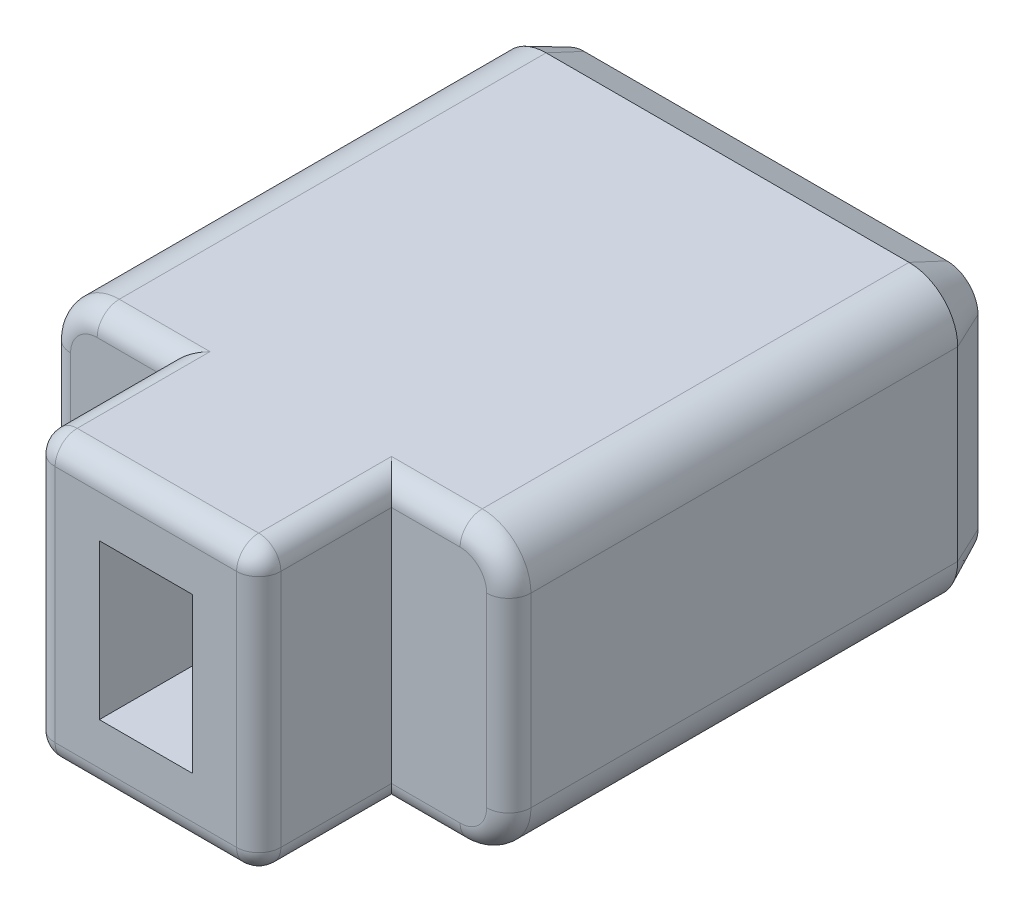
from build123d import *

# Parameters (mm, degrees)
BOSS_EXTRU_1_DEPTH      = 14
ESQUISSE3_W             = 2.1
ESQUISSE3_H             = 3.5
ENL_V_MAT_EXTRU_1_DEPTH = 3
ESQUISSE4_OUTSIDE_W     = 16.116
ESQUISSE4_OUTSIDE_H     = 12.116
ESQUISSE4_OUTSIDE_W_2   = 5.1
ESQUISSE4_OUTSIDE_H_2   = 6.4
ENL_V_MAT_EXTRU_2_DEPTH = 3
CONG_1_R                = 0.5
CHANFREIN1_SIZE         = 0.4
CHANFREIN1_SIZE2        = 0.857802768
ENL_V_MAT_EXTRU_3_DEPTH = 0.3
BOSS_EXTRU_2_DEPTH      = 0.3


with BuildPart() as part:
    # Esquisse2 → Boss.-Extru.1 (new body)
    with BuildSketch(Plane.XY):
        with BuildLine():
            Line((1.1, 0), (9.3, 0))
            ThreePointArc((9.3, 0), (10.077817459, 0.322182541), (10.4, 1.1))
            Line((10.4, 1.1), (10.4, 5.3))
            ThreePointArc((10.4, 5.3), (10.077817459, 6.077817459), (9.3, 6.4))
            Line((9.3, 6.4), (1.1, 6.4))
            ThreePointArc((1.1, 6.4), (0.322182541, 6.077817459), (0, 5.3))
            Line((0, 5.3), (0, 1.1))
            ThreePointArc((0, 1.1), (0.322182541, 0.322182541), (1.1, 0))
        make_face()
    extrude(amount=BOSS_EXTRU_1_DEPTH)

    # Esquisse3 → Enlèv. mat.-Extru.1 (cut)
    with BuildSketch(Plane.XY.offset(14)):
        with Locations((5.2, 3.2)):
            Rectangle(ESQUISSE3_W, ESQUISSE3_H)
    extrude(amount=-ENL_V_MAT_EXTRU_1_DEPTH, mode=Mode.SUBTRACT)

    # Esquisse4 outside → Enlèv. mat.-Extru.2 (cut)
    with BuildSketch(Plane.XY.offset(14)):
        with Locations((5.2, 3.2)):
            Rectangle(ESQUISSE4_OUTSIDE_W, ESQUISSE4_OUTSIDE_H)
        with Locations((5.2, 3.2)):
            Rectangle(ESQUISSE4_OUTSIDE_W_2, ESQUISSE4_OUTSIDE_H_2, mode=Mode.SUBTRACT)
    extrude(amount=-ENL_V_MAT_EXTRU_2_DEPTH, mode=Mode.SUBTRACT)

    # Congé1
    cong_1_edges = [part.edges().sort_by_distance(p)[0] for p in [
        (8.525, 0, 11),
        (10.077817459, 0.322182541, 11),
        (10.4, 3.2, 11),
        (10.077817459, 6.077817459, 11),
        (1.875, 6.4, 11),
        (0.322182541, 6.077817459, 11),
        (1.875, 0, 11),
        (0.322182541, 0.322182541, 11),
        (7.75, 6.4, 12.5),
        (2.65, 6.4, 12.5),
        (7.75, 0, 12.5),
        (2.65, 0, 12.5),
        (2.65, 3.2, 14),
        (5.2, 6.4, 14),
        (7.75, 3.2, 14),
        (5.2, 0, 14),
        (8.525, 6.4, 11),
        (0, 3.2, 11),
    ]]
    fillet(cong_1_edges, radius=CONG_1_R)

    # Chanfrein1
    chanfrein1_edges = [part.edges().sort_by_distance(p)[0] for p in [
        (5.2, 0, 0),
        (10.077817459, 0.322182541, 0),
        (0.322182541, 0.322182541, 0),
        (10.4, 3.2, 0),
        (0, 3.2, 0),
        (10.077817459, 6.077817459, 0),
        (0.322182541, 6.077817459, 0),
        (5.2, 6.4, 0),
    ]]
    chanfrein1_side = [part.faces().sort_by_distance(p)[0] for p in [
        (5.2, 3.2, 0),
    ]]
    chamfer(chanfrein1_edges, length=CHANFREIN1_SIZE, length2=CHANFREIN1_SIZE2, reference=chanfrein1_side[0])

    # Esquisse5 → Enlèv. mat.-Extru.3 (cut)
    with BuildSketch(Plane(origin=(0, 0, 0), x_dir=(-1, 0, 0), z_dir=(0, 0, -1))):
        Polygon((-5.947596154, 1.197435897), (-6.020512821, 1.197435897), (-6.020512821, 3.966666667), (-6.430769231, 3.966666667), (-6.430769231, 4.376923077), (-6.020512821, 4.376923077), (-6.020512821, 5.3), (-5.661538462, 5.3), (-5.661538462, 4.376923077), (-4.020512821, 4.376923077), align=None)
        Polygon((-5.661538462, 3.966666667), (-5.661538462, 2.387339744), (-4.704807692, 3.966666667), align=None, mode=Mode.SUBTRACT)
    extrude(amount=-ENL_V_MAT_EXTRU_3_DEPTH, mode=Mode.SUBTRACT)


with BuildPart() as body_2:
    # Esquisse5<2> → Boss.-Extru.2 (new body)
    with BuildSketch(Plane(origin=(0, 0, 0), x_dir=(-1, 0, 0), z_dir=(0, 0, -1))):
        Polygon((-5.947596154, 1.197435897), (-6.020512821, 1.197435897), (-6.020512821, 3.966666667), (-6.430769231, 3.966666667), (-6.430769231, 4.376923077), (-6.020512821, 4.376923077), (-6.020512821, 5.3), (-5.661538462, 5.3), (-5.661538462, 4.376923077), (-4.020512821, 4.376923077), align=None)
        Polygon((-5.661538462, 3.966666667), (-5.661538462, 2.387339744), (-4.704807692, 3.966666667), align=None, mode=Mode.SUBTRACT)
    extrude(amount=BOSS_EXTRU_2_DEPTH)


solid = Compound([part.part, body_2.part])
